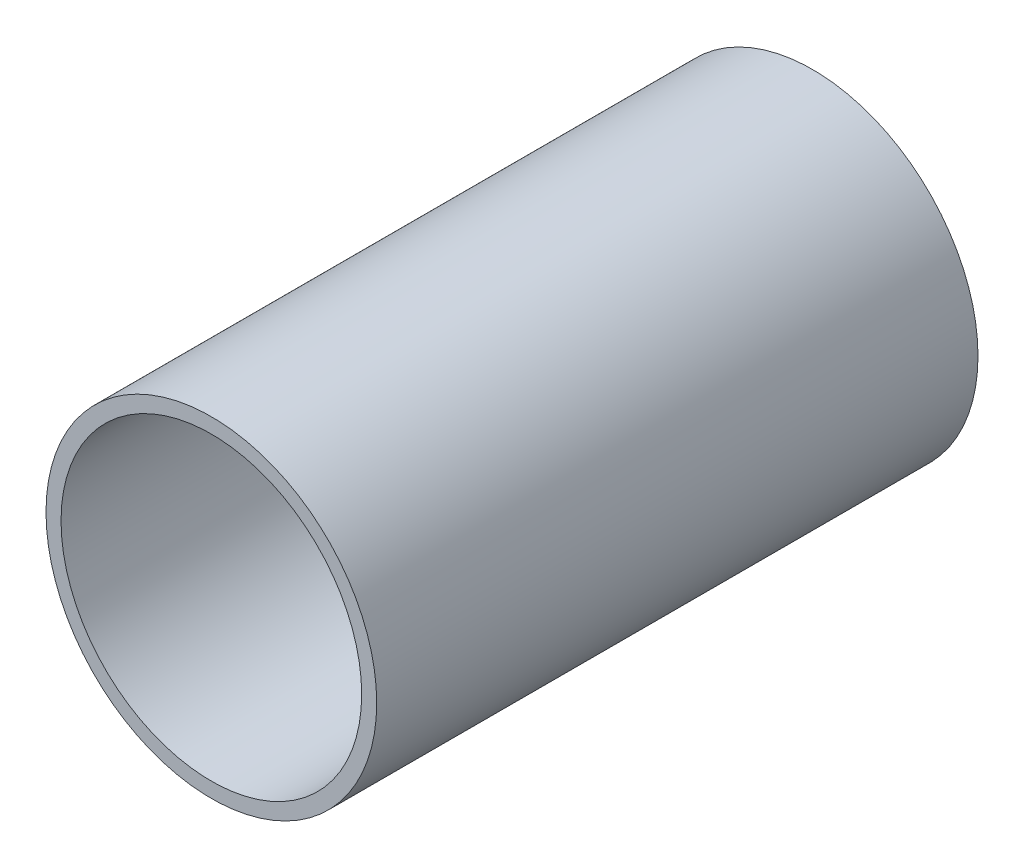
from build123d import *

# Parameters (mm, degrees)
SKETCH1_R           = 419.1
SKETCH1_R_2         = 381
BOSS_EXTRUDE1_DEPTH = 762


with BuildPart() as part:
    # Sketch1 → Boss-Extrude1 (new, symmetric)
    with BuildSketch(Plane.XY):
        Circle(SKETCH1_R)
        Circle(SKETCH1_R_2, mode=Mode.SUBTRACT)
    extrude(amount=BOSS_EXTRUDE1_DEPTH, both=True)


solid = part.part
